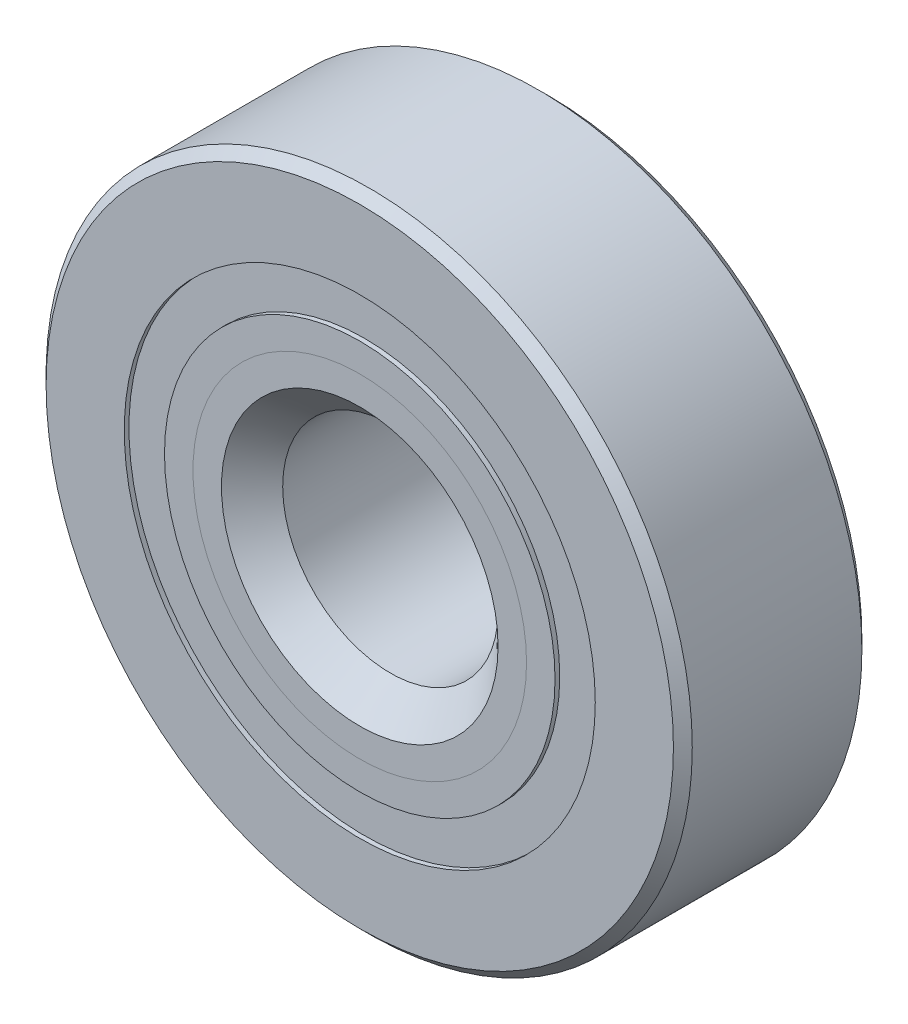
from build123d import *

# Parameters (mm, degrees)
CIRPATTERN1_COUNT = 10
SKETCH5_W         = 1.269421546
SKETCH5_H         = 1.186263736


with BuildPart() as part:
    # Sketch1 → Revolve1 (revolve)
    with BuildSketch(Plane(origin=(0, 0, 0), x_dir=(0, 0, -1), z_dir=(1, 0, 0))):
        with BuildLine():
            Line((2.5003125, 9.525), (-2.5003125, 9.525))
            Line((-2.5003125, 9.525), (-2.778125, 9.2471875))
            Line((-2.778125, 9.2471875), (-2.778125, 6.943131868))
            Line((-2.778125, 6.943131868), (-1.234722222, 6.943131868))
            ThreePointArc((-1.234722222, 6.943131868), (0, 7.719797204), (1.234722222, 6.943131868))
            Line((1.234722222, 6.943131868), (2.778125, 6.943131868))
            Line((2.778125, 6.943131868), (2.778125, 9.2471875))
            Line((2.778125, 9.2471875), (2.5003125, 9.525))
        make_face()
    revolve(axis=Axis((0, 0, 2.778125), (0, 0, -1)))


with BuildPart() as body_2:
    # Sketch2 → Revolve2 (revolve)
    with BuildSketch(Plane(origin=(0, 0, 0), x_dir=(0, 0, -1), z_dir=(1, 0, 0))):
        with BuildLine():
            Line((-2.778125, 5.756868132), (-1.234722222, 5.756868132))
            ThreePointArc((-1.234722222, 5.756868132), (-0.729340114, 5.190514176), (0, 4.980202796))
            Line((0, 4.980202796), (0, 4.077601398))
            Line((0, 4.077601398), (-1.938491633, 4.077601398))
            Line((-1.938491633, 4.077601398), (-2.778125, 4.917234765))
            Line((-2.778125, 4.917234765), (-2.778125, 5.756868132))
        make_face()
    revolve(axis=Axis((0, 0, 2.778125), (0, 0, -1)))


with BuildPart() as body_3:
    # Sketch3 → Revolve3 (revolve)
    with BuildSketch(Plane(origin=(0, 0, 0), x_dir=(0, 0, -1), z_dir=(1, 0, 0))):
        with BuildLine():
            Line((-2.778125, 4.917234765), (-1.938491633, 4.077601398))
            Line((-1.938491633, 4.077601398), (0, 4.077601398))
            Line((0, 4.077601398), (0, 4.980202796))
            ThreePointArc((0, 4.980202796), (0.729340114, 5.190514176), (1.234722222, 5.756868132))
            Line((1.234722222, 5.756868132), (2.778125, 5.756868132))
            Line((2.778125, 5.756868132), (2.778125, 3.4528125))
            Line((2.778125, 3.4528125), (2.5003125, 3.175))
            Line((2.5003125, 3.175), (-1.875523602, 3.175))
            Line((-1.875523602, 3.175), (-2.778125, 4.077601398))
            Line((-2.778125, 4.077601398), (-2.778125, 4.917234765))
        make_face()
    revolve(axis=Axis((0, 0, 2.778125), (0, 0, -1)))


with BuildPart() as body_4:
    # Sketch4 → Revolve4 (revolve)
    with BuildSketch(Plane(origin=(0, 0, 0), x_dir=(0, 0, -1), z_dir=(1, 0, 0))):
        with BuildLine():
            Line((-1.369797204, 6.35), (1.369797204, 6.35))
            ThreePointArc((1.369797204, 6.35), (0, 7.719797204), (-1.369797204, 6.35))
        make_face()
    revolve(axis=Axis((0, 6.35, 1.369797204), (0, 0, -1)))


with BuildPart() as cirpattern1_1:
    # CirPattern1: pattern copy
    add(body_4.part.rotate(Axis((0, 0, -2.778125), (0, 0, 1)), 1 * 360 / CIRPATTERN1_COUNT))


with BuildPart() as cirpattern1_2:
    # CirPattern1: pattern copy
    add(body_4.part.rotate(Axis((0, 0, -2.778125), (0, 0, 1)), 2 * 360 / CIRPATTERN1_COUNT))


with BuildPart() as cirpattern1_3:
    # CirPattern1: pattern copy
    add(body_4.part.rotate(Axis((0, 0, -2.778125), (0, 0, 1)), 3 * 360 / CIRPATTERN1_COUNT))


with BuildPart() as cirpattern1_4:
    # CirPattern1: pattern copy
    add(body_4.part.rotate(Axis((0, 0, -2.778125), (0, 0, 1)), 4 * 360 / CIRPATTERN1_COUNT))


with BuildPart() as cirpattern1_5:
    # CirPattern1: pattern copy
    add(body_4.part.rotate(Axis((0, 0, -2.778125), (0, 0, 1)), 5 * 360 / CIRPATTERN1_COUNT))


with BuildPart() as cirpattern1_6:
    # CirPattern1: pattern copy
    add(body_4.part.rotate(Axis((0, 0, -2.778125), (0, 0, 1)), 6 * 360 / CIRPATTERN1_COUNT))


with BuildPart() as cirpattern1_7:
    # CirPattern1: pattern copy
    add(body_4.part.rotate(Axis((0, 0, -2.778125), (0, 0, 1)), 7 * 360 / CIRPATTERN1_COUNT))


with BuildPart() as cirpattern1_8:
    # CirPattern1: pattern copy
    add(body_4.part.rotate(Axis((0, 0, -2.778125), (0, 0, 1)), 8 * 360 / CIRPATTERN1_COUNT))


with BuildPart() as cirpattern1_9:
    # CirPattern1: pattern copy
    add(body_4.part.rotate(Axis((0, 0, -2.778125), (0, 0, 1)), 9 * 360 / CIRPATTERN1_COUNT))


with BuildPart() as body_14:
    # Sketch5 → Revolve5 (revolve)
    with BuildSketch(Plane(origin=(0, 0, 0), x_dir=(0, 0, -1), z_dir=(1, 0, 0))):
        with Locations((-2.004507977, 6.35)):
            Rectangle(SKETCH5_W, SKETCH5_H)
        with Locations((2.004507977, 6.35)):
            Rectangle(SKETCH5_W, SKETCH5_H)
    revolve(axis=Axis((0, 0, 2.778125), (0, 0, -1)))


solid = Compound([part.part, body_2.part, body_3.part, body_4.part, cirpattern1_1.part, cirpattern1_2.part, cirpattern1_3.part, cirpattern1_4.part, cirpattern1_5.part, cirpattern1_6.part, cirpattern1_7.part, cirpattern1_8.part, cirpattern1_9.part, body_14.part])
